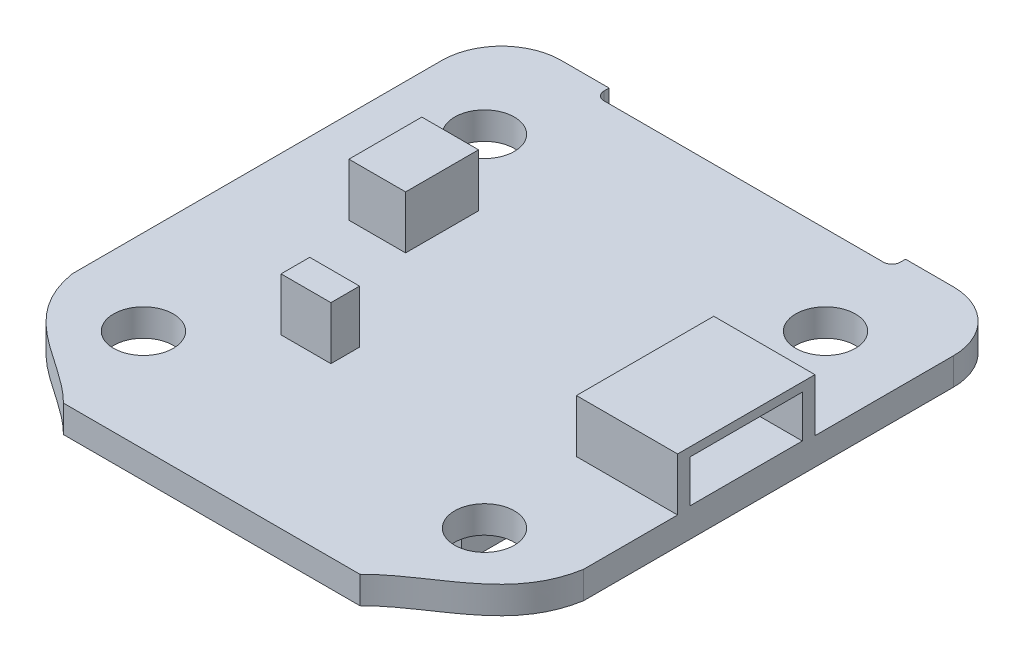
from build123d import *

# Parameters (mm, degrees)
SKETCH1_R           = 1.75
BOSS_EXTRUDE1_DEPTH = 1.6
SKETCH2_W           = 5.933953942
SKETCH2_H           = 8.053817615
SKETCH2_W_2         = 3.324070188
SKETCH2_H_2         = 4.276777171
SKETCH2_W_3         = 2.922259506
SKETCH2_H_3         = 1.680299216
BOSS_EXTRUDE2_DEPTH = 3.1
SKETCH3_W           = 3.740844247
SKETCH3_H           = 4.973122352
SKETCH3_W_2         = 11.134512877
SKETCH3_H_2         = 14.391247869
BOSS_EXTRUDE3_DEPTH = 3.1
SKETCH4_W           = 6.597488945
SKETCH4_H           = 2.482560273
CUT_EXTRUDE1_DEPTH  = 5.1


with BuildPart() as part:
    # Sketch1 → Boss-Extrude1 (new body)
    with BuildSketch(Plane(origin=(0, 0, 0), x_dir=(1, 0, 0), z_dir=(0, 1, 0))):
        with BuildLine():
            Line((-8.692785485, -16), (8.692785485, -16))
            add(Edge.make_bspline(
                [(15, -9.18383354), (14.366330033, -12.951143486), (10.86731964, -13.80158376), (8.692785485, -16)],
                knots=[0, 0, 0, 0, 0.915310456, 0.915310456, 0.915310456, 0.915310456], degree=3))
            Line((15, -9.18383354), (15, 12.5))
            ThreePointArc((15, 12.5), (13.974873734, 14.974873734), (11.5, 16))
            Line((11.5, 16), (8.692785485, 16))
            Line((8.692785485, 16), (8.692785485, 15.700659593))
            ThreePointArc((8.692785485, 15.700659593), (8.546338876, 15.347106203), (8.192785485, 15.200659593))
            Line((8.192785485, 15.200659593), (-8.192785485, 15.200659593))
            ThreePointArc((-8.192785485, 15.200659593), (-8.546338876, 15.347106203), (-8.692785485, 15.700659593))
            Line((-8.692785485, 15.700659593), (-8.692785485, 16))
            Line((-8.692785485, 16), (-11.5, 16))
            ThreePointArc((-11.5, 16), (-13.974873734, 14.974873734), (-15, 12.5))
            Line((-15, 12.5), (-15, -9.18383354))
            add(Edge.make_bspline(
                [(-15, -9.18383354), (-14.366330033, -12.951143486), (-10.86731964, -13.80158376), (-8.692785485, -16)],
                knots=[0, 0, 0, 0, 0.915310456, 0.915310456, 0.915310456, 0.915310456], degree=3))
        make_face()
        with Locations(Location((-10, 10, 0), (0, 0, 270))):
            Circle(SKETCH1_R, mode=Mode.SUBTRACT)
        with Locations(Location((10, 10, 0), (0, 0, 270))):
            Circle(SKETCH1_R, mode=Mode.SUBTRACT)
        with Locations(Location((10, -10, 0), (0, 0, 270))):
            Circle(SKETCH1_R, mode=Mode.SUBTRACT)
        with Locations(Location((-10, -10, 0), (0, 0, 270))):
            Circle(SKETCH1_R, mode=Mode.SUBTRACT)
    extrude(amount=BOSS_EXTRUDE1_DEPTH)

    # Sketch2 → Boss-Extrude2 (add)
    with BuildSketch(Plane(origin=(0, 1.6, 0), x_dir=(1, 0, 0), z_dir=(0, 1, 0))):
        with Locations((12.033023029, 0.352079458)):
            Rectangle(SKETCH2_W, SKETCH2_H)
        with Locations((-7.946367365, 3.796471816)):
            Rectangle(SKETCH2_W_2, SKETCH2_H_2)
        with Locations((-4.311807104, -5.315838698)):
            Rectangle(SKETCH2_W_3, SKETCH2_H_3)
    extrude(amount=BOSS_EXTRUDE2_DEPTH)

    # Sketch3 → Boss-Extrude3 (add)
    with BuildSketch(Plane.XZ):
        with Locations((-10.100279468, -2.904655533)):
            Rectangle(SKETCH3_W, SKETCH3_H)
        with Locations((0.902203613, 0.616139053)):
            Rectangle(SKETCH3_W_2, SKETCH3_H_2)
    extrude(amount=BOSS_EXTRUDE3_DEPTH)

    # Sketch4 → Cut-Extrude1 (cut)
    with BuildSketch(Plane(origin=(15, 0, 0), x_dir=(0, 0, -1), z_dir=(1, 0, 0))):
        with Locations((0.34007675, 2.942483523)):
            Rectangle(SKETCH4_W, SKETCH4_H)
    extrude(amount=-CUT_EXTRUDE1_DEPTH, mode=Mode.SUBTRACT)


solid = part.part
